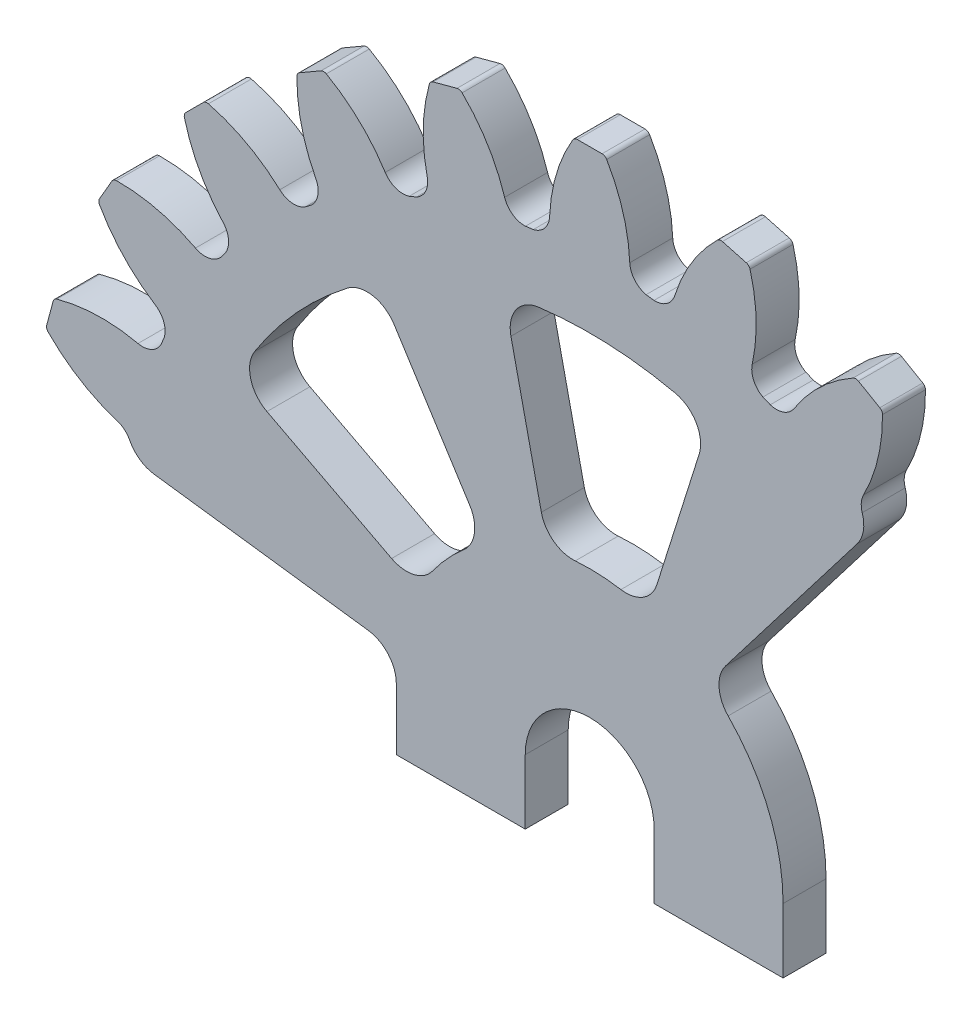
from build123d import *

# Parameters (mm, degrees)
SKETCH3_R                = 136.611351841
EXTRUDE1_DEPTH           = 12.7
EXTRUDE2_DEPTH           = 12.7
FILLET2_R                = 1.5875
CIRPATTERN1_COUNT        = 24
FILLET2_OF_CIRPATTERN1_R = 1.5875
CUT_EXTRUDE1_DEPTH       = 234.890969431
CUT_EXTRUDE1_DEPTH_BACK  = 234.890969431
CUT_EXTRUDE2_REACH       = 232.646
SKETCH5_R                = 19.05
EXTRUDE3_DEPTH           = 12.7
CUT_EXTRUDE5_DEPTH       = 231.646456089
FILLET1_R                = 9.525
CUT_EXTRUDE7_DEPTH       = 12.7


with BuildPart() as part:
    # Sketch3 → Extrude1 (new body)
    with BuildSketch(Plane.XY):
        Circle(SKETCH3_R)
    extrude(amount=EXTRUDE1_DEPTH)

    # Sketch2 → Extrude2 (add)
    with BuildSketch(Plane.XY):
        with BuildLine():
            Line((-4.546074008, 165.141901983), (4.546074008, 165.141901983))
            ThreePointArc((4.546074008, 165.141901983), (9.719017906, 153.717756782), (11.846410355, 141.35876639))
            ThreePointArc((11.846410355, 141.35876639), (13.677789854, 137.226095775), (17.83135957, 135.442622788))
            Line((17.83135957, 135.442622788), (17.83135957, 110.042622788))
            Line((17.83135957, 110.042622788), (-17.83135957, 110.042622788))
            Line((-17.83135957, 110.042622788), (-17.83135957, 135.442622788))
            ThreePointArc((-17.83135957, 135.442622788), (-13.677789854, 137.226095775), (-11.846410355, 141.35876639))
            ThreePointArc((-11.846410355, 141.35876639), (-9.719017906, 153.717756782), (-4.546074008, 165.141901983))
        make_face()
    extrude2 = extrude(amount=EXTRUDE2_DEPTH)

    # Fillet2
    fillet2_edges = [part.edges().sort_by_distance(p)[0] for p in [
        (4.546074008, 165.141901983, 6.35),
        (-4.546074008, 165.141901983, 6.35),
    ]]
    fillet(fillet2_edges, radius=FILLET2_R)

    # CirPattern1: Extrude2 ×24 about axis
    cirpattern1_axis = Axis((0, 0, 0), (0, 0, 1))
    for i in range(1, CIRPATTERN1_COUNT):
        add(extrude2.rotate(cirpattern1_axis, i * 360 / CIRPATTERN1_COUNT))

    # Fillet2 of CirPattern1
    fillet2_of_cirpattern1_edges = [part.edges().sort_by_distance(p)[0] for p in [
        (-38.350699085, 160.691438662, 6.35),
        (-47.13303967, 158.338217595, 6.35),
        (-78.633935413, 145.290119351, 6.35),
        (-86.50796657, 140.744045343, 6.35),
        (-113.558398992, 119.987518509, 6.35),
        (-119.987518509, 113.558398992, 6.35),
        (-140.744045343, 86.50796657, 6.35),
        (-145.290119351, 78.633935413, 6.35),
        (-158.338217595, 47.13303967, 6.35),
        (-160.691438662, 38.350699085, 6.35),
        (-165.141901983, 4.546074008, 6.35),
        (-165.141901983, -4.546074008, 6.35),
        (-160.691438662, -38.350699085, 6.35),
        (-158.338217595, -47.13303967, 6.35),
        (-145.290119351, -78.633935413, 6.35),
        (-140.744045343, -86.50796657, 6.35),
        (-119.987518509, -113.558398992, 6.35),
        (-113.558398992, -119.987518509, 6.35),
        (-86.50796657, -140.744045343, 6.35),
        (-78.633935413, -145.290119351, 6.35),
        (-47.13303967, -158.338217595, 6.35),
        (-38.350699085, -160.691438662, 6.35),
        (-4.546074008, -165.141901983, 6.35),
        (4.546074008, -165.141901983, 6.35),
        (38.350699085, -160.691438662, 6.35),
        (47.13303967, -158.338217595, 6.35),
        (78.633935413, -145.290119351, 6.35),
        (86.50796657, -140.744045343, 6.35),
        (113.558398992, -119.987518509, 6.35),
        (119.987518509, -113.558398992, 6.35),
        (140.744045343, -86.50796657, 6.35),
        (145.290119351, -78.633935413, 6.35),
        (158.338217595, -47.13303967, 6.35),
        (160.691438662, -38.350699085, 6.35),
        (165.141901983, -4.546074008, 6.35),
        (165.141901983, 4.546074008, 6.35),
        (160.691438662, 38.350699085, 6.35),
        (158.338217595, 47.13303967, 6.35),
        (145.290119351, 78.633935413, 6.35),
        (140.744045343, 86.50796657, 6.35),
        (119.987518509, 113.558398992, 6.35),
        (113.558398992, 119.987518509, 6.35),
        (86.50796657, 140.744045343, 6.35),
        (78.633935413, 145.290119351, 6.35),
        (47.13303967, 158.338217595, 6.35),
        (38.350699085, 160.691438662, 6.35),
    ]]
    fillet(fillet2_of_cirpattern1_edges, radius=FILLET2_OF_CIRPATTERN1_R)

    # Sketch4 → Cut-Extrude1 (cut, two sides: drawn at the far end of the back side and taken through both)
    with BuildSketch(Plane.XY.offset(-CUT_EXTRUDE1_DEPTH_BACK)):
        Polygon((-1275.53694573, 167.92762467), (-268.218413087, 35.311623982), (0, 0), (164.689969961, 214.628147505), (783.198061827, 1020.683586133), (1560.818943381, -856.6592925), (-497.916064176, -1709.415253962), align=None)
    extrude(amount=CUT_EXTRUDE1_DEPTH + CUT_EXTRUDE1_DEPTH_BACK, mode=Mode.SUBTRACT)

    # Sketch5 → Cut-Extrude2 (cut, up to next)
    with BuildSketch(Plane.XY, mode=Mode.PRIVATE) as cut_extrude2_sk1:
        Circle(SKETCH5_R)
    cut_extrude2_tool1 = extrude(cut_extrude2_sk1.sketch, amount=CUT_EXTRUDE2_REACH, mode=Mode.PRIVATE) & part.part
    add(cut_extrude2_tool1.solids().sort_by_distance((0, 0, 0))[0], mode=Mode.SUBTRACT)

    # Sketch6 → Extrude3 (add)
    with BuildSketch(Plane.XY):
        with BuildLine():
            Line((-19.05, 0), (-19.05, -19.05))
            Line((-19.05, -19.05), (-57.15, -19.05))
            Line((-57.15, -19.05), (-57.15, 0))
            ThreePointArc((-57.15, 0), (-57.027637463, 3.737788836), (-56.661073828, 7.459571885))
            Line((-56.661073828, 7.459571885), (-18.887024609, 2.486523962))
            ThreePointArc((-18.887024609, 2.486523962), (-19.009212488, 1.245929612), (-19.05, 0))
        make_face()
        with BuildLine():
            Line((11.596905223, 15.113381133), (34.790715668, 45.340143398))
            ThreePointArc((34.790715668, 45.340143398), (51.256277179, 25.276798646), (57.15, 0))
            Line((57.15, 0), (57.15, -19.05))
            Line((57.15, -19.05), (19.05, -19.05))
            Line((19.05, -19.05), (19.05, 0))
            ThreePointArc((19.05, 0), (17.085425726, 8.425599549), (11.596905223, 15.113381133))
        make_face()
    extrude(amount=EXTRUDE3_DEPTH)

    # Sketch8 → Cut-Extrude5 (cut, through all)
    with BuildSketch(Plane.XY):
        with BuildLine():
            Line((-25.426243647, 114.690373436), (-12.369523937, 55.795316807))
            ThreePointArc((-12.369523937, 55.795316807), (2.492847988, 57.095605863), (17.185336442, 54.504923735))
            Line((17.185336442, 54.504923735), (35.325413797, 112.037898789))
            ThreePointArc((35.325413797, 112.037898789), (5.124187531, 117.36318983), (-25.426243647, 114.690373436))
        make_face()
        with BuildLine():
            Line((-63.119271491, 99.077410097), (-30.706672617, 48.199821128))
            ThreePointArc((-30.706672617, 48.199821128), (-42.135399799, 38.609980365), (-50.692669116, 26.388933246))
            Line((-50.692669116, 26.388933246), (-104.201597628, 54.24391834))
            ThreePointArc((-104.201597628, 54.24391834), (-86.611655142, 79.36495964), (-63.119271491, 99.077410097))
        make_face()
    extrude(amount=CUT_EXTRUDE5_DEPTH, mode=Mode.SUBTRACT)

    # Fillet1
    fillet1_edges = [part.edges().sort_by_distance(p)[0] for p in [
        (34.790715668, 45.340143398, 6.35),
        (-50.692669116, 26.388933246, 6.35),
        (-30.706672617, 48.199821128, 6.35),
        (-63.119271491, 99.077410097, 6.35),
        (-104.201597628, 54.24391834, 6.35),
        (-12.369523937, 55.795316807, 6.35),
        (17.185336442, 54.504923735, 6.35),
        (35.325413797, 112.037898789, 6.35),
        (-25.426243647, 114.690373436, 6.35),
        (-56.661073828, 7.459571885, 6.35),
        (-57.15, 0, 6.35),
    ]]
    fillet(fillet1_edges, radius=FILLET1_R)

    # Sketch9 → Cut-Extrude7 (cut)
    with BuildSketch(Plane.XY):
        with BuildLine():
            Line((79.034097122, 102.999240689), (83.809524096, 109.222698287))
            Line((83.809524096, 109.222698287), (80.539107883, 111.732176909))
            ThreePointArc((80.539107883, 111.732176909), (80.864034333, 107.180027092), (79.034097122, 102.999240689))
        make_face()
        with BuildLine():
            Line((-128.717007568, 16.945915528), (-136.494393434, 17.969827802))
            Line((-136.494393434, 17.969827802), (-135.956329304, 22.056830634))
            ThreePointArc((-135.956329304, 22.056830634), (-132.967230996, 18.608216933), (-128.717007568, 16.945915528))
        make_face()
    extrude(amount=CUT_EXTRUDE7_DEPTH, mode=Mode.SUBTRACT)


solid = part.part
